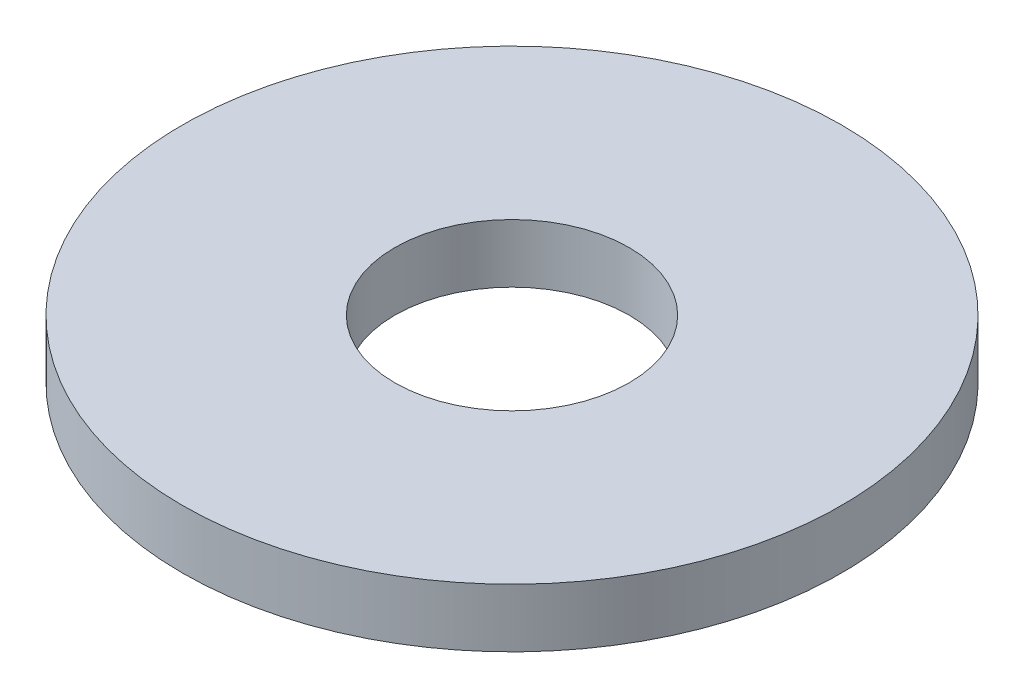
from build123d import *

# Parameters (mm, degrees)
SKETCH1_R           = 4.5
SKETCH1_R_2         = 1.6
BOSS_EXTRUDE1_DEPTH = 0.8


with BuildPart() as part:
    # Sketch1 → Boss-Extrude1 (new body)
    with BuildSketch(Plane(origin=(0, 0, 0), x_dir=(1, 0, 0), z_dir=(0, 1, 0))):
        with Locations(Location((0, 0, 0), (0, 0, 270))):
            Circle(SKETCH1_R)
        with Locations(Location((0, 0, 0), (0, 0, 270))):
            Circle(SKETCH1_R_2, mode=Mode.SUBTRACT)
    extrude(amount=BOSS_EXTRUDE1_DEPTH)


solid = part.part
